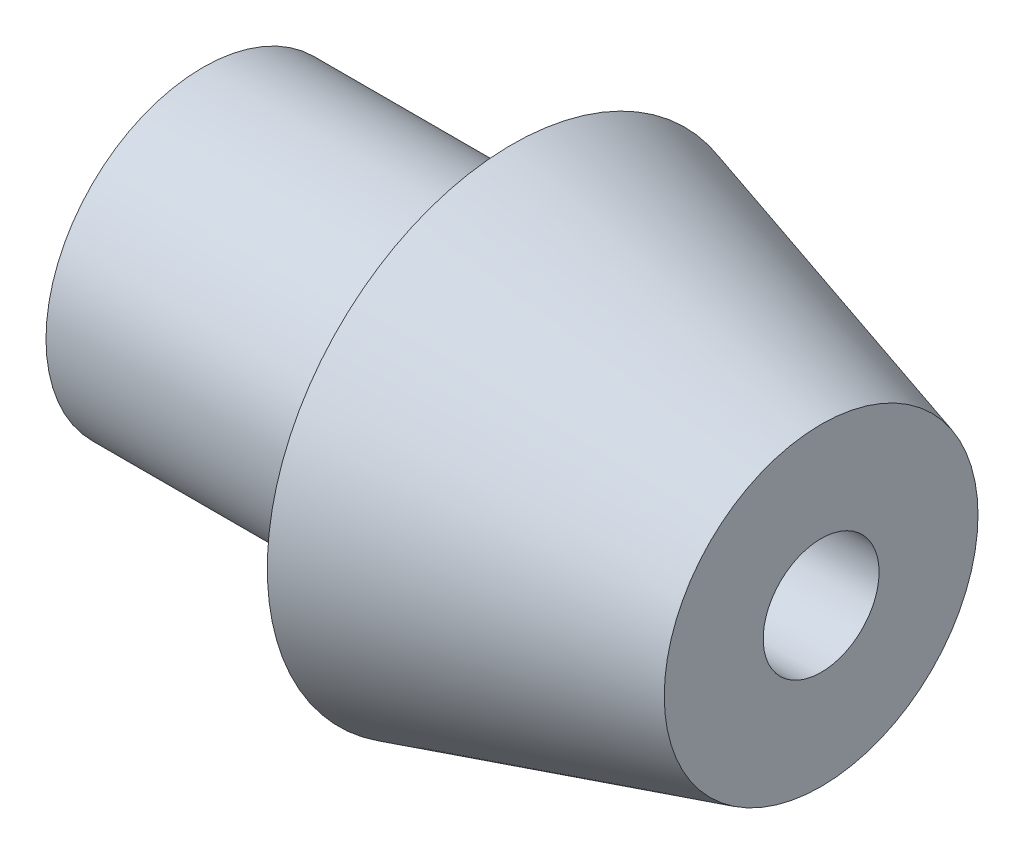
from build123d import *

# Parameters (mm, degrees)
LUMEN_REACH         = 11.007
SKETCH5_R           = 1.125
SKETCH6_R           = 3.044910248
SKETCH6_R_2         = 1.125
MINCHANNEL_DEPTH    = 6
BARBCHANNELFILLET_R = 1


with BuildPart() as part:
    # Sketch4 → Barb (revolve)
    with BuildSketch(Plane.XY, mode=Mode.PRIVATE) as barb_sk:
        Polygon((-8.593939394, 0), (-8.593939394, 4.75), (-2.593939394, 3.044910248), (-2.593939394, 0), align=None)
    revolve(barb_sk.sketch.rotate(Axis((0, 0, 0), (-1, 0, 0)), 90), axis=Axis((0, 0, 0), (-1, 0, 0)))

    # Sketch5 → Lumen (cut, up to next)
    with BuildSketch(Plane(origin=(-2.593939394, 0, 0), x_dir=(0, 0, -1), z_dir=(1, 0, 0)), mode=Mode.PRIVATE) as lumen_sk1:
        Circle(SKETCH5_R)
    lumen_tool1 = extrude(lumen_sk1.sketch, amount=-LUMEN_REACH, mode=Mode.PRIVATE) & part.part
    add(lumen_tool1.solids().sort_by_distance((-2.593939, 0, 0))[0], mode=Mode.SUBTRACT)

    # Sketch6 → MinChannel (add)
    with BuildSketch(Plane.ZY.offset(8.593939394)):
        Circle(SKETCH6_R)
        with Locations(Location((0, 0, 0), (0, 0, 180))):
            Circle(SKETCH6_R_2, mode=Mode.SUBTRACT)
    extrude(amount=MINCHANNEL_DEPTH)

    # BarbChannelFillet
    barbchannelfillet_edges = [part.edges().sort_by_distance(p)[0] for p in [
        (-8.593939394, 0, -3.044910248),
    ]]
    fillet(barbchannelfillet_edges, radius=BARBCHANNELFILLET_R)


solid = part.part
